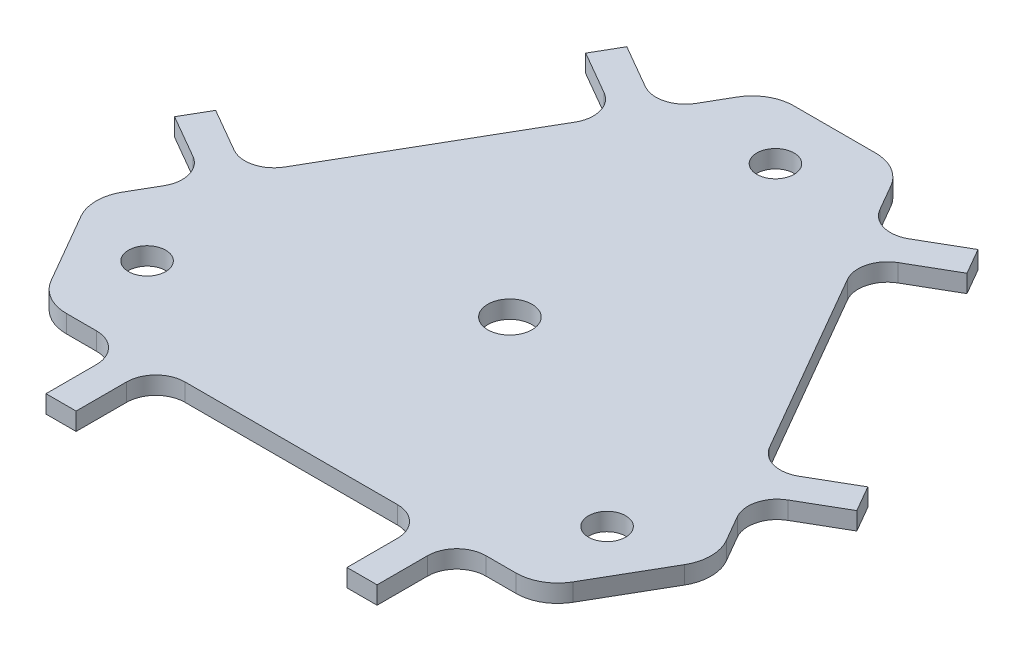
from build123d import *

# Parameters (mm, degrees)
BOSS_EXTRUDE1_DEPTH = 2
SKETCH4_R           = 2.1
CUT_EXTRUDE1_DEPTH  = 105.611811864
SKETCH5_R           = 2.5
CUT_EXTRUDE2_DEPTH  = 105.611811864


with BuildPart() as part:
    # Sketch1 → Boss-Extrude1 (new body)
    with BuildSketch(Plane(origin=(0, 0, 0), x_dir=(1, 0, 0), z_dir=(0, 1, 0))):
        with BuildLine():
            Line((49.096295698, 65.225835767), (47.394589776, 68.173276884))
            ThreePointArc((47.394589776, 68.173276884), (45.674270378, 69.893596282), (43.324270378, 70.523276884))
            Line((43.324270378, 70.523276884), (34.086666071, 70.523276884))
            ThreePointArc((34.086666071, 70.523276884), (31.736666071, 69.893596282), (30.016346673, 68.173276884))
            Line((30.016346673, 68.173276884), (28.314640751, 65.225835767))
            ThreePointArc((28.314640751, 65.225835767), (26.310859767, 63.688280541), (23.806756919, 64.017951935))
            Line((23.806756919, 64.017951935), (18.870412117, 66.867951935))
            Line((18.870412117, 66.867951935), (17.170412117, 63.923465562))
            Line((17.170412117, 63.923465562), (22.106756919, 61.073465562))
            ThreePointArc((22.106756919, 61.073465562), (23.644312145, 59.069684578), (23.314640751, 56.565581729))
            Line((23.314640751, 56.565581729), (11.314640751, 35.780972039))
            ThreePointArc((11.314640751, 35.780972039), (9.310859767, 34.243416812), (6.806756919, 34.573088206))
            Line((6.806756919, 34.573088206), (1.870412117, 37.423088206))
            Line((1.870412117, 37.423088206), (0.170412117, 34.478601833))
            Line((0.170412117, 34.478601833), (5.106756919, 31.628601833))
            ThreePointArc((5.106756919, 31.628601833), (6.644312145, 29.62482085), (6.314640751, 27.120718001))
            Line((6.314640751, 27.120718001), (4.612934829, 24.173276884))
            ThreePointArc((4.612934829, 24.173276884), (3.983254227, 21.823276884), (4.612934829, 19.473276884))
            Line((4.612934829, 19.473276884), (9.231736982, 11.473276884))
            ThreePointArc((9.231736982, 11.473276884), (10.95205638, 9.752957486), (13.30205638, 9.123276884))
            Line((13.30205638, 9.123276884), (16.705468225, 9.123276884))
            ThreePointArc((16.705468225, 9.123276884), (19.038920602, 8.156729262), (20.005468225, 5.823276884))
            Line((20.005468225, 5.823276884), (20.005468225, 0.123276884))
            Line((20.005468225, 0.123276884), (23.405468225, 0.123276884))
            Line((23.405468225, 0.123276884), (23.405468225, 5.823276884))
            ThreePointArc((23.405468225, 5.823276884), (24.372015847, 8.156729262), (26.705468225, 9.123276884))
            Line((26.705468225, 9.123276884), (50.705468225, 9.123276884))
            ThreePointArc((50.705468225, 9.123276884), (53.038920602, 8.156729262), (54.005468225, 5.823276884))
            Line((54.005468225, 5.823276884), (54.005468225, 0.123276884))
            Line((54.005468225, 0.123276884), (57.405468225, 0.123276884))
            Line((57.405468225, 0.123276884), (57.405468225, 5.823276884))
            ThreePointArc((57.405468225, 5.823276884), (58.372015847, 8.156729262), (60.705468225, 9.123276884))
            Line((60.705468225, 9.123276884), (64.108880069, 9.123276884))
            ThreePointArc((64.108880069, 9.123276884), (66.458880069, 9.752957486), (68.179199467, 11.473276884))
            Line((68.179199467, 11.473276884), (72.79800162, 19.473276884))
            ThreePointArc((72.79800162, 19.473276884), (73.427682222, 21.823276884), (72.79800162, 24.173276884))
            Line((72.79800162, 24.173276884), (71.096295698, 27.120718001))
            ThreePointArc((71.096295698, 27.120718001), (70.766624304, 29.62482085), (72.304179531, 31.628601833))
            Line((72.304179531, 31.628601833), (77.240524332, 34.478601833))
            Line((77.240524332, 34.478601833), (75.540524332, 37.423088206))
            Line((75.540524332, 37.423088206), (70.604179531, 34.573088206))
            ThreePointArc((70.604179531, 34.573088206), (68.100076682, 34.243416812), (66.096295698, 35.780972039))
            Line((66.096295698, 35.780972039), (54.096295698, 56.565581729))
            ThreePointArc((54.096295698, 56.565581729), (53.766624304, 59.069684578), (55.304179531, 61.073465562))
            Line((55.304179531, 61.073465562), (60.240524332, 63.923465562))
            Line((60.240524332, 63.923465562), (58.540524332, 66.867951935))
            Line((58.540524332, 66.867951935), (53.604179531, 64.017951935))
            ThreePointArc((53.604179531, 64.017951935), (51.100076682, 63.688280541), (49.096295698, 65.225835767))
        make_face()
    extrude(amount=BOSS_EXTRUDE1_DEPTH)

    # Sketch4 → Cut-Extrude1 (cut, through all)
    with BuildSketch(Plane(origin=(0, 2, 0), x_dir=(1, 0, 0), z_dir=(0, 1, 0))):
        with Locations(Location((38.705468225, 63.823276884, 0), (0, 0, 270))):
            Circle(SKETCH4_R)
        with Locations(Location((12.724706111, 18.823276884, 0), (0, 0, 270))):
            Circle(SKETCH4_R)
        with Locations(Location((64.686230338, 18.823276884, 0), (0, 0, 270))):
            Circle(SKETCH4_R)
    extrude(amount=-CUT_EXTRUDE1_DEPTH, mode=Mode.SUBTRACT)

    # Sketch5 → Cut-Extrude2 (cut, through all)
    with BuildSketch(Plane(origin=(0, 2, 0), x_dir=(1, 0, 0), z_dir=(0, 1, 0))):
        with Locations(Location((38.705468225, 33.823276884, 0), (0, 0, 270))):
            Circle(SKETCH5_R)
    extrude(amount=-CUT_EXTRUDE2_DEPTH, mode=Mode.SUBTRACT)


solid = part.part
